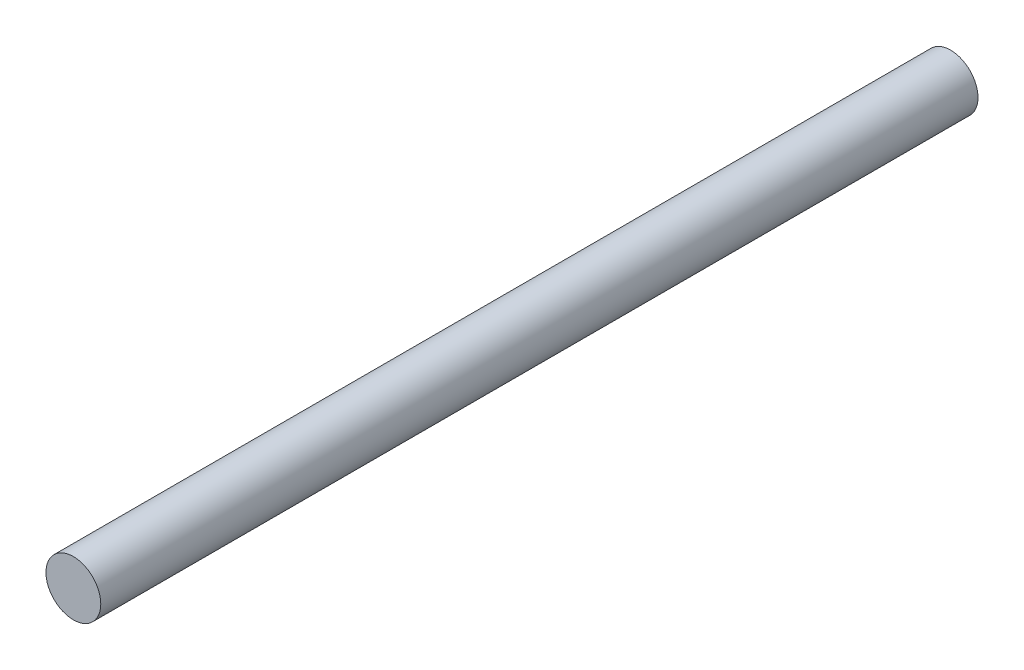
from build123d import *

# Parameters (mm, degrees)
SKETCH1_R           = 3
BOSS_EXTRUDE1_DEPTH = 96


with BuildPart() as part:
    # Sketch1 → Boss-Extrude1 (new body)
    with BuildSketch(Plane.XY):
        Circle(SKETCH1_R)
    extrude(amount=BOSS_EXTRUDE1_DEPTH)


solid = part.part
